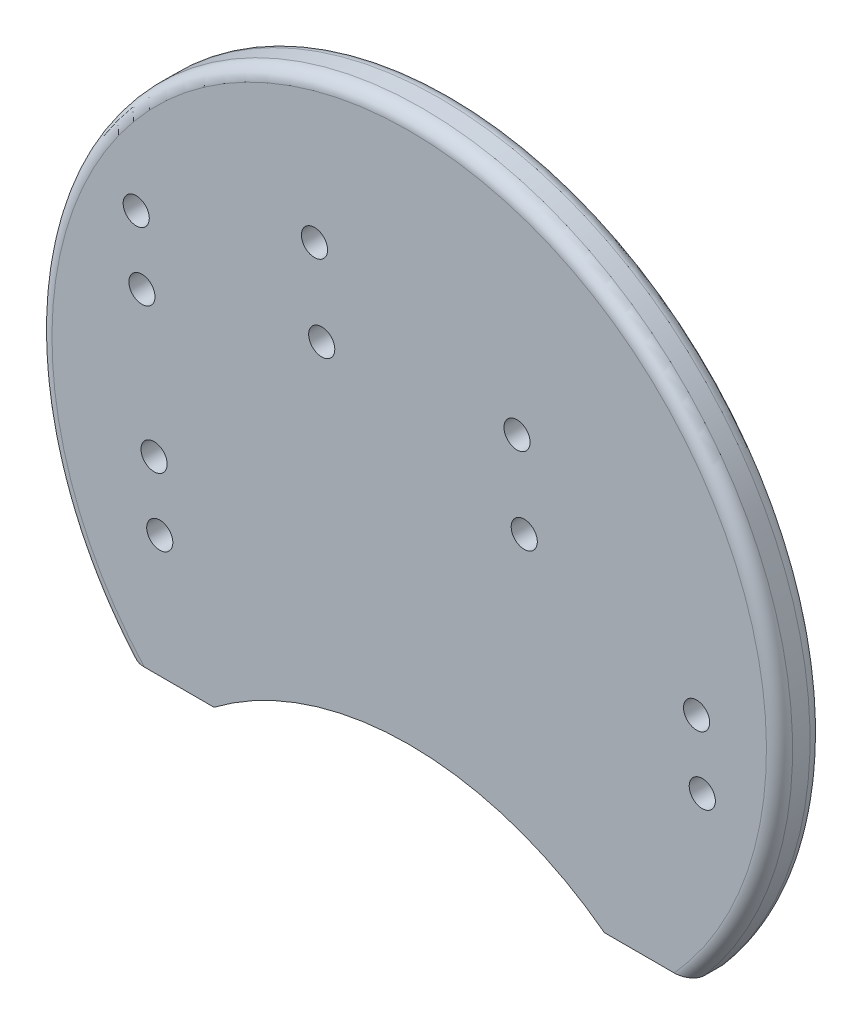
from build123d import *

# Parameters (mm, degrees)
EXTRUDE_1_DEPTH     = 5
SKETCH_2_R          = 3
CUT_EXTRUDE_2_DEPTH = 5
FILLET_1_R          = 3


with BuildPart() as part:
    # 草圖1 → 伸長1 (new, symmetric)
    with BuildSketch(Plane.XY):
        with BuildLine():
            ThreePointArc((85, 0), (-29.294798227, 79.792322919), (-64.807406984, -55))
            Line((-64.807406984, -55), (-44.807406984, -55))
            ThreePointArc((-44.807406984, -55), (0, -40), (44.807406984, -55))
            Line((44.807406984, -55), (64.807406984, -55))
            ThreePointArc((64.807406984, -55), (79.792322919, -29.294798227), (85, 0))
        make_face()
    extrude(amount=EXTRUDE_1_DEPTH, both=True)

    # 草圖2 → 伸長2 (cut)
    with BuildSketch(Plane.XY.offset(5)):
        with Locations((-57.257089563, -27)):
            Circle(SKETCH_2_R)
        with Locations((-58.564425704, -12.057079529)):
            Circle(SKETCH_2_R)
        with Locations((-61.353409472, 19.82115081)):
            Circle(SKETCH_2_R)
        with Locations((-62.660745613, 34.764071282)):
            Circle(SKETCH_2_R)
        with Locations((-21.739469319, 48.927699264)):
            Circle(SKETCH_2_R)
        with Locations((-20.083510207, 30)):
            Circle(SKETCH_2_R)
        with Locations((24.744753323, 33.927699264)):
            Circle(SKETCH_2_R)
        with Locations((26.400712435, 15)):
            Circle(SKETCH_2_R)
        with Locations((65.959911557, -1.162611685)):
            Circle(SKETCH_2_R)
        with Locations((67.267247699, -16.105532157)):
            Circle(SKETCH_2_R)
    extrude(amount=-CUT_EXTRUDE_2_DEPTH, mode=Mode.SUBTRACT)

    # 圓角1
    fillet_1_edges = [part.edges().sort_by_distance(p)[0] for p in [
        (0, 85, 5),
        (0, 85, -5),
    ]]
    fillet(fillet_1_edges, radius=FILLET_1_R)


solid = part.part
